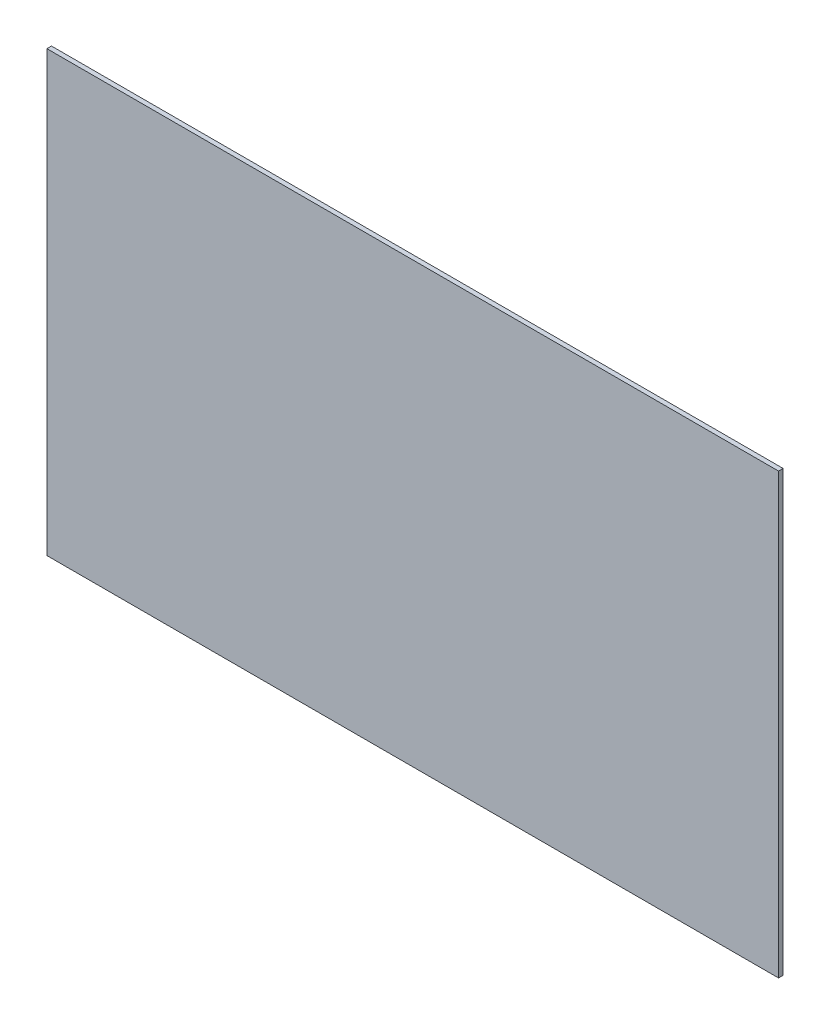
from build123d import *

# Parameters (mm, degrees)
SKETCH1_W           = 508
SKETCH1_H           = 304.8
BOSS_EXTRUDE1_DEPTH = 1.5875


with BuildPart() as part:
    # Sketch1 → Boss-Extrude1 (new, symmetric)
    with BuildSketch(Plane.XY):
        Rectangle(SKETCH1_W, SKETCH1_H)
    extrude(amount=BOSS_EXTRUDE1_DEPTH, both=True)


solid = part.part
